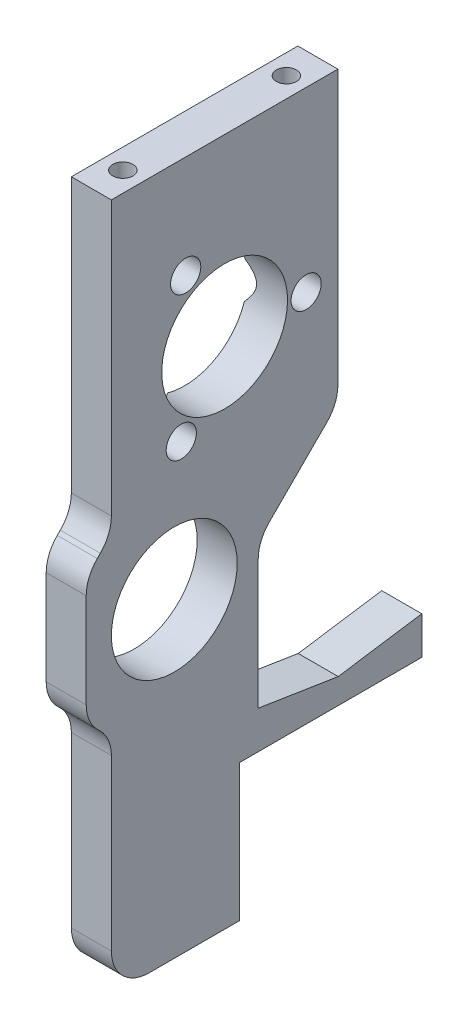
from build123d import *

# Parameters (mm, degrees)
BOSS_EXTRUDE1_DEPTH                             = 3.18
SKETCH2_4_OUTSIDE_W                             = 40.858
SKETCH2_4_OUTSIDE_H                             = 68.888
SKETCH2_4_OUTSIDE_R                             = 5
CUT_EXTRUDE2_DEPTH                              = 3.18
FILLET6_R                                       = 3
M2X0_4_TAPPED_HOLE1_D                           = 1.6
M2X0_4_TAPPED_HOLE1_DEPTH                       = 5.519311505
M2X0_4_TAPPED_HOLE1_TIP                         = 0.480688495
CUT_EXTRUDE3_REACH                              = 40.129
SKETCH7_R                                       = 1
CSK_FOR_M2_FLAT_HEAD_MACHINE_SCREW1_D           = 2.4
CSK_FOR_M2_FLAT_HEAD_MACHINE_SCREW1_DEPTH       = 3.18
CSK_FOR_M2_FLAT_HEAD_MACHINE_SCREW1_CSINK_D     = 4.4
CSK_FOR_M2_FLAT_HEAD_MACHINE_SCREW1_CSINK_ANGLE = 90


with BuildPart() as part:
    # Sketch2 → Boss-Extrude1 (new body)
    with BuildSketch(Plane(origin=(0, 0, 0), x_dir=(0, 0, -1), z_dir=(1, 0, 0))):
        Polygon((-7.39959254, 19.413571875), (10.60040746, 19.413571875), (10.60040746, -3.586428125), (4.27040746, -9.916428125), (4.27040746, -21.406428125), (10.625315102, -22.406428125), (17.27040746, -21.406428125), (17.27040746, -24.406428125), (2.77040746, -24.406428125), (2.77040746, -35.286428125), (-7.39959254, -35.286428125), (-7.39959254, -17.586428125), (-9.39959254, -15.586428125), (-9.39959254, -5.586428125), (-7.39959254, -3.586428125), align=None)
    extrude(amount=-BOSS_EXTRUDE1_DEPTH)

    # Sketch2<4> outside → Cut-Extrude2 (cut)
    # profile 1 of 3: a face of its own
    with BuildSketch(Plane(origin=(0, 0, 0), x_dir=(0, 0, -1), z_dir=(1, 0, 0))):
        with Locations((3.935, -7.936)):
            Rectangle(SKETCH2_4_OUTSIDE_W, SKETCH2_4_OUTSIDE_H)
        Polygon((-7.39959254, 19.413571875), (10.60040746, 19.413571875), (10.60040746, -3.586428125), (4.27040746, -9.916428125), (4.27040746, -21.406428125), (10.625315102, -22.406428125), (17.27040746, -21.406428125), (17.27040746, -24.406428125), (2.77040746, -24.406428125), (2.77040746, -35.286428125), (-7.39959254, -35.286428125), (-7.39959254, -17.586428125), (-9.39959254, -15.586428125), (-9.39959254, -5.586428125), (-7.39959254, -3.586428125), align=None, mode=Mode.SUBTRACT)
    # profile 2 of 3: a face of its own
    with BuildSketch(Plane(origin=(0, 0, 0), x_dir=(0, 0, -1), z_dir=(1, 0, 0))):
        with Locations((-2.39959254, -10.586428125)):
            Circle(SKETCH2_4_OUTSIDE_R)
    # profile 3 of 3: a face of its own
    with BuildSketch(Plane(origin=(0, 0, 0), x_dir=(0, 0, -1), z_dir=(1, 0, 0))):
        with Locations((1.60040746, 5.524437773)):
            Circle(SKETCH2_4_OUTSIDE_R)
    extrude(amount=-CUT_EXTRUDE2_DEPTH, mode=Mode.SUBTRACT)

    # Fillet6
    fillet6_edges = [part.edges().sort_by_distance(p)[0] for p in [
        (-1.59, -3.586428125, 7.39959254),
        (-1.59, -5.586428125, 9.39959254),
        (-1.59, -15.586428125, 9.39959254),
        (-1.59, -17.586428125, 7.39959254),
        (-1.59, -35.286428125, 7.39959254),
        (-1.59, -9.916428125, -4.27040746),
        (-1.59, -3.586428125, -10.60040746),
    ]]
    fillet(fillet6_edges, radius=FILLET6_R)

    # M2x0.4 Tapped Hole1
    with Locations(Plane(origin=(0, 19.413571875, 0), x_dir=(1, 0, 0), z_dir=(0, 1, 0))):
        with Locations((-1.59, 8.10040746), (-1.59, -4.89959254)):
            Hole(M2X0_4_TAPPED_HOLE1_D / 2, depth=M2X0_4_TAPPED_HOLE1_DEPTH)
            with Locations((0, 0, -(M2X0_4_TAPPED_HOLE1_DEPTH + M2X0_4_TAPPED_HOLE1_TIP / 2))):  # 118° drill point
                Cone(0, M2X0_4_TAPPED_HOLE1_D / 2, M2X0_4_TAPPED_HOLE1_TIP, mode=Mode.SUBTRACT)

    # Sketch7 → Cut-Extrude3 (cut, up to next)
    with BuildSketch(Plane(origin=(0, 0, -3.18), x_dir=(0, 0, -1), z_dir=(1, 0, 0)), mode=Mode.PRIVATE) as cut_extrude3_sk1:
        with Locations((-4.67466251, 11.25391193)):
            Circle(SKETCH7_R)
    cut_extrude3_tool1 = extrude(cut_extrude3_sk1.sketch, amount=-CUT_EXTRUDE3_REACH, mode=Mode.PRIVATE) & part.part
    # Sketch7 → Cut-Extrude3 (cut, up to next)
    with BuildSketch(Plane(origin=(0, 0, -3.18), x_dir=(0, 0, -1), z_dir=(1, 0, 0)), mode=Mode.PRIVATE) as cut_extrude3_sk2:
        with Locations((4.896479829, 5.325738996)):
            Circle(SKETCH7_R)
    cut_extrude3_tool2 = extrude(cut_extrude3_sk2.sketch, amount=-CUT_EXTRUDE3_REACH, mode=Mode.PRIVATE) & part.part
    # Sketch7 → Cut-Extrude3 (cut, up to next)
    with BuildSketch(Plane(origin=(0, 0, -3.18), x_dir=(0, 0, -1), z_dir=(1, 0, 0)), mode=Mode.PRIVATE) as cut_extrude3_sk3:
        with Locations((-5.023039699, 0.000973054)):
            Circle(SKETCH7_R)
    cut_extrude3_tool3 = extrude(cut_extrude3_sk3.sketch, amount=-CUT_EXTRUDE3_REACH, mode=Mode.PRIVATE) & part.part
    add(cut_extrude3_tool1.solids().sort_by_distance((0, 11.253912, 1.494663))[0], mode=Mode.SUBTRACT)
    add(cut_extrude3_tool2.solids().sort_by_distance((0, 5.325739, -8.07648))[0], mode=Mode.SUBTRACT)
    add(cut_extrude3_tool3.solids().sort_by_distance((0, 0.000973, 1.84304))[0], mode=Mode.SUBTRACT)

    # CSK for M2 Flat Head Machine Screw1
    with Locations(Plane.ZY.offset(3.18)):
        with Locations((-8.076479829, 5.325738996), (1.49466251, 11.25391193), (1.843039699, 0.000973054)):
            CounterSinkHole(CSK_FOR_M2_FLAT_HEAD_MACHINE_SCREW1_D / 2, CSK_FOR_M2_FLAT_HEAD_MACHINE_SCREW1_CSINK_D / 2, depth=CSK_FOR_M2_FLAT_HEAD_MACHINE_SCREW1_DEPTH, counter_sink_angle=CSK_FOR_M2_FLAT_HEAD_MACHINE_SCREW1_CSINK_ANGLE)


solid = part.part
